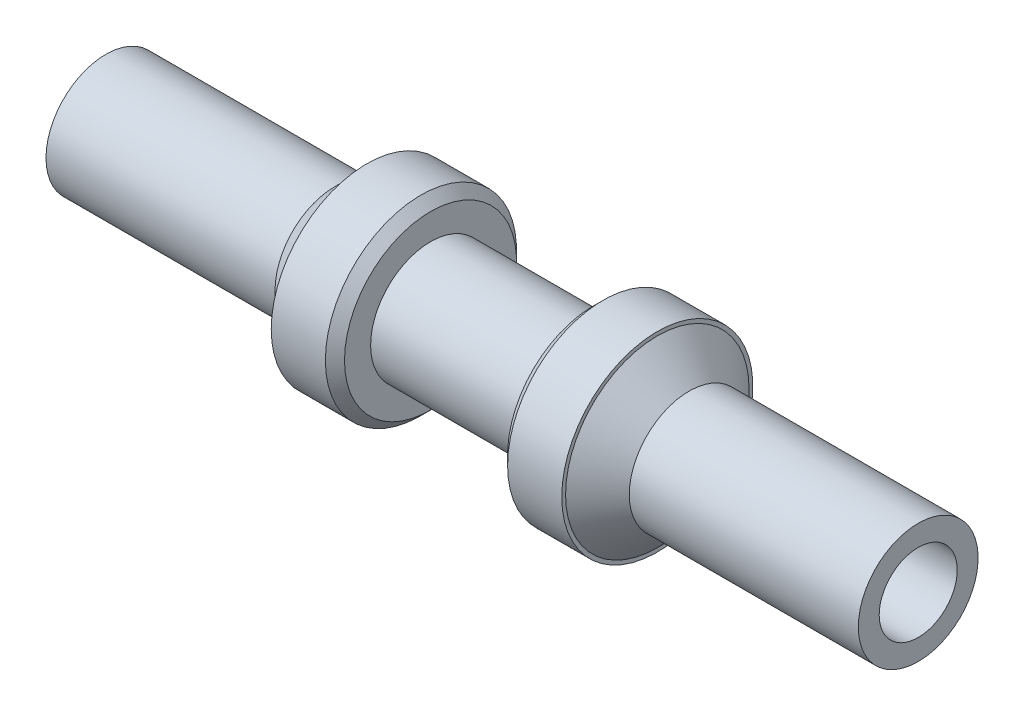
from build123d import *

# Parameters (mm, degrees)
CHAMFER1_SIZE = 0.762
CHAMFER2_SIZE = 2.54


with BuildPart() as part:
    # Sketch1 → Revolve1 (revolve)
    with BuildSketch(Plane.XY, mode=Mode.PRIVATE) as revolve1_sk:
        Polygon((0, 3.1115), (0, 4.7752), (20.8026, 4.7752), (20.8026, 7.62), (25.8826, 7.62), (25.8826, 4.7752), (38.8874, 4.7752), (38.8874, 7.62), (43.9674, 7.62), (43.9674, 4.7752), (64.77, 4.7752), (64.77, 3.1115), align=None)
    revolve(revolve1_sk.sketch.rotate(Axis((0, 0, 0), (1, 0, 0)), 90), axis=Axis((0, 0, 0), (1, 0, 0)))

    # Chamfer1
    chamfer1_edges = [part.edges().sort_by_distance(p)[0] for p in [
        (38.8874, 0, -7.62),
        (25.8826, 0, -7.62),
    ]]
    chamfer(chamfer1_edges, length=CHAMFER1_SIZE)

    # Chamfer2
    chamfer2_edges = [part.edges().sort_by_distance(p)[0] for p in [
        (43.9674, 0, -4.7752),
        (20.8026, 0, -4.7752),
    ]]
    chamfer(chamfer2_edges, length=CHAMFER2_SIZE)


solid = part.part
